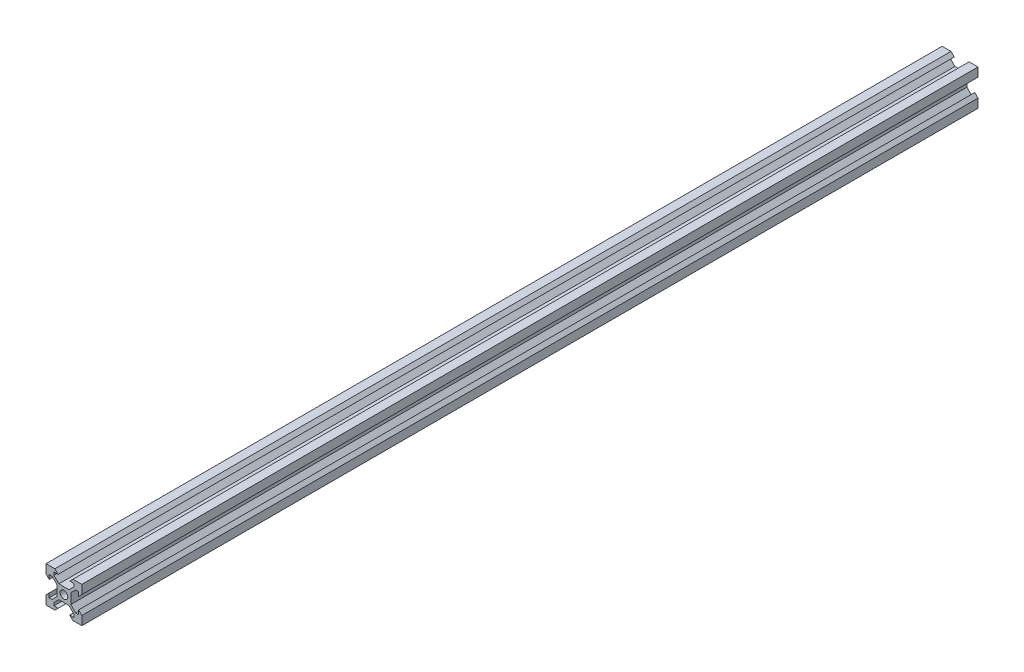
from build123d import *

# Parameters (mm, degrees)
CROQUIS1_R              = 2.15
SALIENTE_EXTRUIR2_DEPTH = 500


with BuildPart() as part:
    # Croquis1 → Saliente-Extruir2 (new body)
    with BuildSketch(Plane.XY):
        Polygon((4.4, 0), (0, 0), (0, -0.56736664), (0, -4.4), (0, -4.95), (1.8, -6.75), (1.8, -4.4), (3.410050506, -4.4), (6.175, -7.164949494), (6.175, -12.835050506), (3.410050506, -15.6), (1.8, -15.6), (1.8, -13.25), (0, -15.05), (0, -15.6), (0, -20), (4.4, -20), (4.95, -20), (6.75, -18.2), (4.4, -18.2), (4.4, -16.589949494), (7.164949494, -13.825), (12.835050506, -13.825), (15.6, -16.589949494), (15.6, -18.2), (13.25, -18.2), (15.05, -20), (15.6, -20), (18.2, -20), (20, -20), (20, -15.6), (20, -15.05), (18.2, -13.25), (18.2, -15.6), (16.589949494, -15.6), (13.825, -12.835050506), (13.825, -7.164949494), (16.589949494, -4.4), (18.2, -4.4), (18.2, -6.75), (20, -4.95), (20, -4.4), (20, 0), (15.6, 0), (15.05, 0), (13.25, -1.8), (15.6, -1.8), (15.6, -3.410050506), (12.835050506, -6.175), (7.164949494, -6.175), (4.4, -3.410050506), (4.4, -1.8), (6.75, -1.8), (4.95, 0), align=None)
        with Locations((10, -10)):
            Circle(CROQUIS1_R, mode=Mode.SUBTRACT)
    extrude(amount=SALIENTE_EXTRUIR2_DEPTH)


solid = part.part
